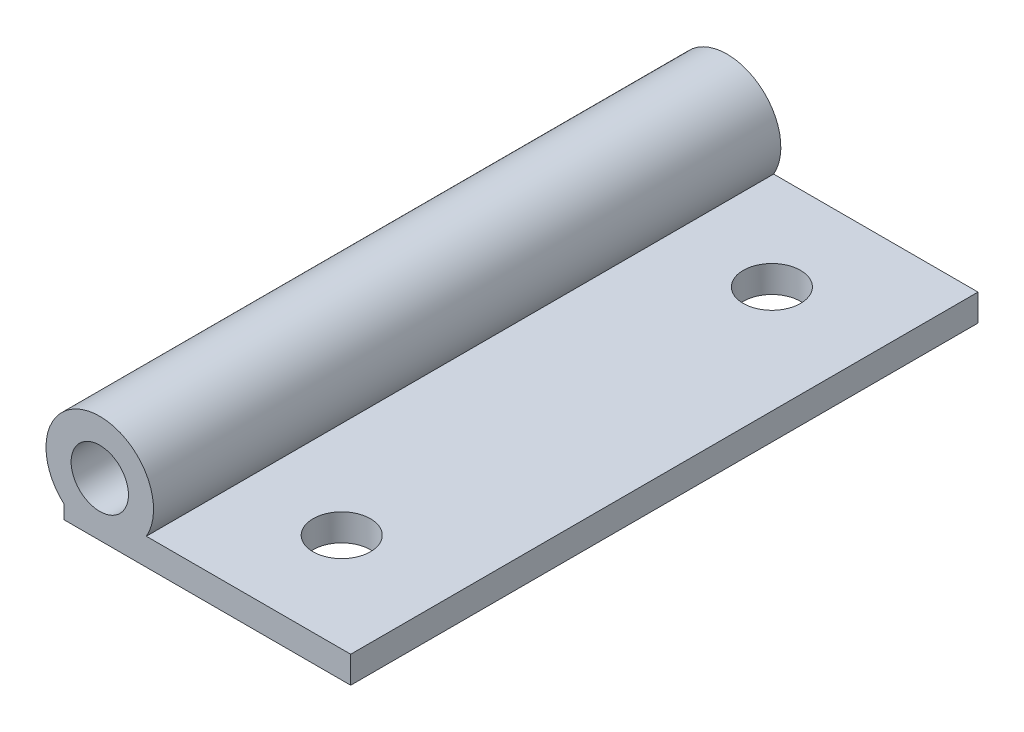
from build123d import *

# Parameters (mm, degrees)
EXTRUDE_START             = -17.5
SKETCH_1_R                = 3
EXTRUDE_231_DEPTH         = 35
SKETCH_2_W                = 16
SKETCH_2_H                = 1.5
EXTRUDE_300_DEPTH         = 35
D3P2_START                = -20
SKETCH_3_R                = 1.6
D3P2_DEPTH                = 40
CUT_EXTRUDE_M3_DEPTH      = 100
CUT_EXTRUDE_M3_DEPTH_BACK = 100
SKETCH_4_R                = 1.6
CUT_EXTRUDE_3_DEPTH       = 100
CUT_EXTRUDE_3_DEPTH_BACK  = 100
SKETCH_5_R                = 1.6


with BuildPart() as part:
    # 草图1 → Extrude 231 (new body)
    with BuildSketch(Plane.XY.offset(EXTRUDE_START)):
        Circle(SKETCH_1_R)
    extrude(amount=EXTRUDE_231_DEPTH)

    # 草图2 → Extrude 300 (add)
    with BuildSketch(Plane.XY.offset(EXTRUDE_START)):
        with Locations((6, -2.25)):
            Rectangle(SKETCH_2_W, SKETCH_2_H)
    extrude(amount=EXTRUDE_300_DEPTH)

    # 草图3 → D3p2活动转轴孔 (cut)
    with BuildSketch(Plane.XY.offset(D3P2_START)):
        Circle(SKETCH_3_R)
    extrude(amount=D3P2_DEPTH, mode=Mode.SUBTRACT)

    # 草图4 → 吊板M3安装孔 (cut, two sides: drawn at the far end of the back side and taken through both)
    with BuildSketch(Plane(origin=(0, 0, 0), x_dir=(1, 0, 0), z_dir=(0, 1, 0)).offset(-CUT_EXTRUDE_M3_DEPTH_BACK)):
        with Locations(Location((8, 12, 0), (0, 0, 270))):
            Circle(SKETCH_4_R)
    extrude(amount=CUT_EXTRUDE_M3_DEPTH + CUT_EXTRUDE_M3_DEPTH_BACK, mode=Mode.SUBTRACT)

    # 草图5 → 切除-拉伸3 (cut, two sides: drawn at the far end of the back side and taken through both)
    with BuildSketch(Plane(origin=(0, 0, 0), x_dir=(1, 0, 0), z_dir=(0, 1, 0)).offset(-CUT_EXTRUDE_3_DEPTH_BACK)):
        with Locations(Location((8, -12, 0), (0, 0, 270))):
            Circle(SKETCH_5_R)
    extrude(amount=CUT_EXTRUDE_3_DEPTH + CUT_EXTRUDE_3_DEPTH_BACK, mode=Mode.SUBTRACT)


solid = part.part
